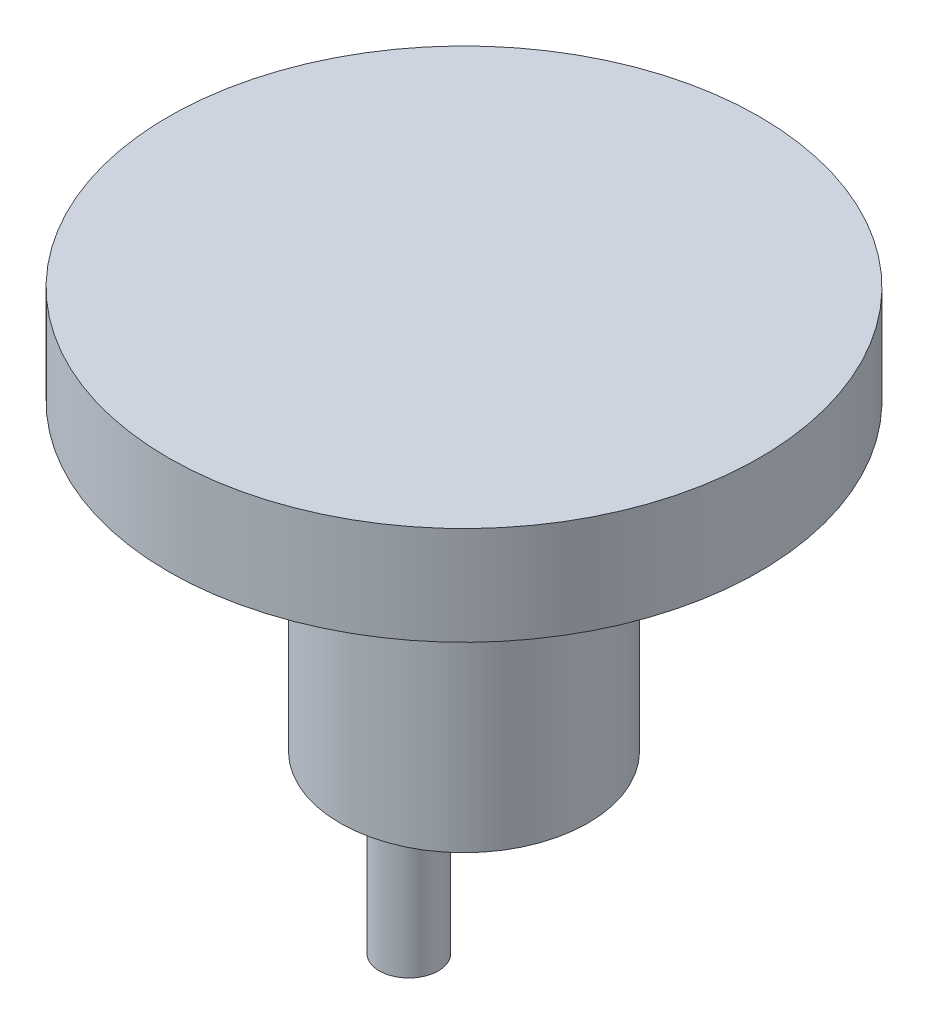
from build123d import *

# Parameters (mm, degrees)
SKETCH1_R           = 12.6
BOSS_EXTRUDE1_DEPTH = 29.3
SKETCH2_R           = 1.75
BOSS_EXTRUDE2_DEPTH = 11.5
SKETCH3_R           = 30
BOSS_EXTRUDE3_DEPTH = 10
SKETCH4_R           = 3
BOSS_EXTRUDE4_DEPTH = 15


with BuildPart() as part:
    # Sketch1 → Boss-Extrude1 (new body)
    with BuildSketch(Plane(origin=(0, 0, 0), x_dir=(1, 0, 0), z_dir=(0, 1, 0))):
        with Locations(Location((0, 0, 0), (0, 0, 270))):
            Circle(SKETCH1_R)
    extrude(amount=BOSS_EXTRUDE1_DEPTH)

    # Sketch2 → Boss-Extrude2 (add)
    with BuildSketch(Plane(origin=(0, 29.3, 0), x_dir=(1, 0, 0), z_dir=(0, 1, 0))):
        with Locations(Location((0, 0, 0), (0, 0, 270))):
            Circle(SKETCH2_R)
    extrude(amount=BOSS_EXTRUDE2_DEPTH)

    # Sketch3 → Boss-Extrude3 (add)
    with BuildSketch(Plane(origin=(0, 40.8, 0), x_dir=(1, 0, 0), z_dir=(0, 1, 0))):
        with Locations(Location((0, 0, 0), (0, 0, 270))):
            Circle(SKETCH3_R)
    extrude(amount=-BOSS_EXTRUDE3_DEPTH)

    # Sketch4 → Boss-Extrude4 (add)
    with BuildSketch(Plane.XZ):
        with Locations(Location((0, 5.6, 0), (0, 0, 270))):
            Circle(SKETCH4_R)
    extrude(amount=BOSS_EXTRUDE4_DEPTH)


solid = part.part
